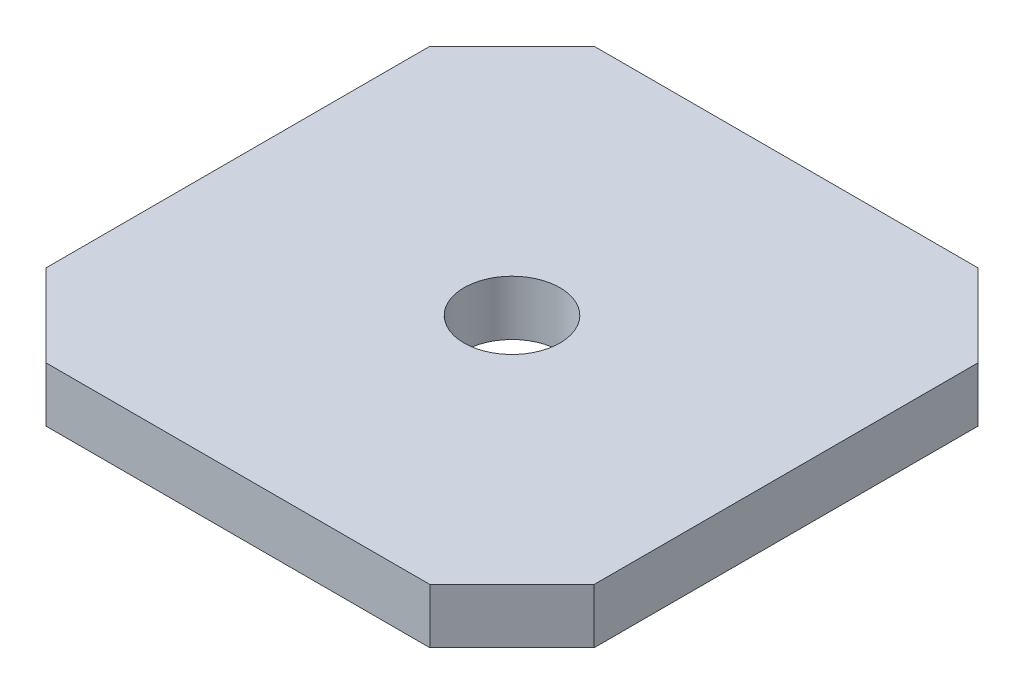
from build123d import *

# Parameters (mm, degrees)
SKETCH1_W           = 20
SKETCH1_H           = 20
SKETCH1_R           = 1.75
BOSS_EXTRUDE1_DEPTH = 2
CHAMFER1_SIZE       = 3


with BuildPart() as part:
    # Sketch1 → Boss-Extrude1 (new body)
    with BuildSketch(Plane(origin=(0, 0, 0), x_dir=(1, 0, 0), z_dir=(0, 1, 0))):
        Rectangle(SKETCH1_W, SKETCH1_H)
        with Locations(Location((0, 0, 0), (0, 0, 270))):
            Circle(SKETCH1_R, mode=Mode.SUBTRACT)
    extrude(amount=BOSS_EXTRUDE1_DEPTH)

    # Chamfer1
    chamfer1_edges = [part.edges().sort_by_distance(p)[0] for p in [
        (-10, 1, -10),
        (10, 1, -10),
        (10, 1, 10),
        (-10, 1, 10),
    ]]
    chamfer(chamfer1_edges, length=CHAMFER1_SIZE)


solid = part.part
